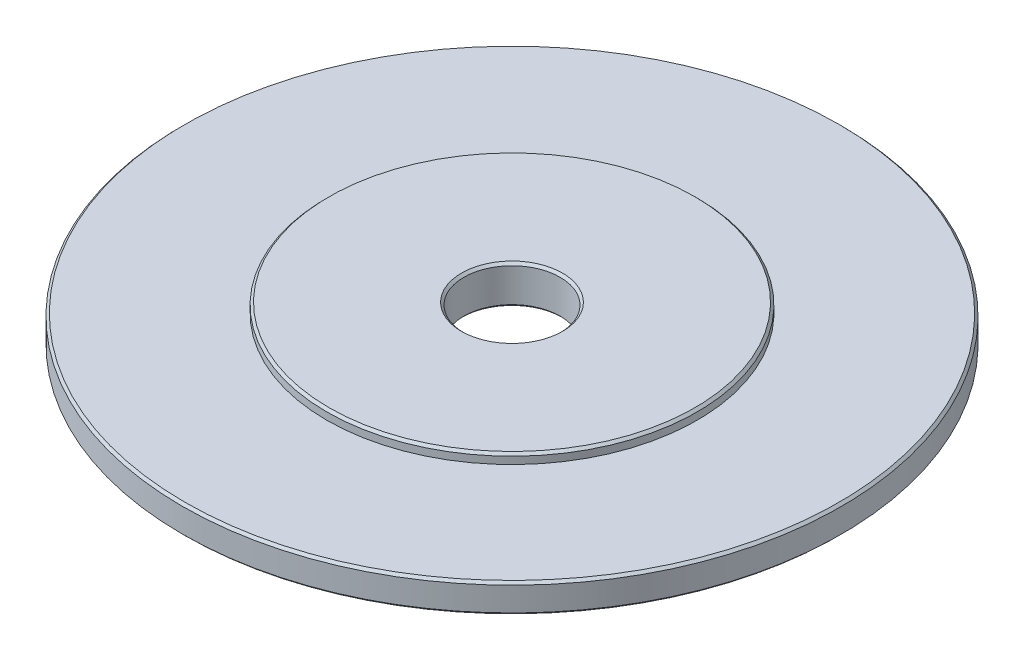
from build123d import *

# Parameters (mm, degrees)
CHAMFER_1_SIZE = 0.5


with BuildPart() as part:
    # 草图2 → 旋转1 (revolve)
    with BuildSketch(Plane(origin=(0, 0, 0), x_dir=(0, 0, -1), z_dir=(1, 0, 0))):
        Polygon((10, 0), (68.5, 0), (68.5, 6), (38.5, 6), (38.5, 8), (10, 8), align=None)
    revolve(axis=Axis((0, 0, 0), (0, 1, 0)))

    # 倒角1
    chamfer_1_edges = [part.edges().sort_by_distance(p)[0] for p in [
        (0, 0, 68.5),
        (0, 0, 10),
        (0, 8, 10),
        (0, 8, 38.5),
        (0, 6, 68.5),
    ]]
    chamfer(chamfer_1_edges, length=CHAMFER_1_SIZE)


solid = part.part
